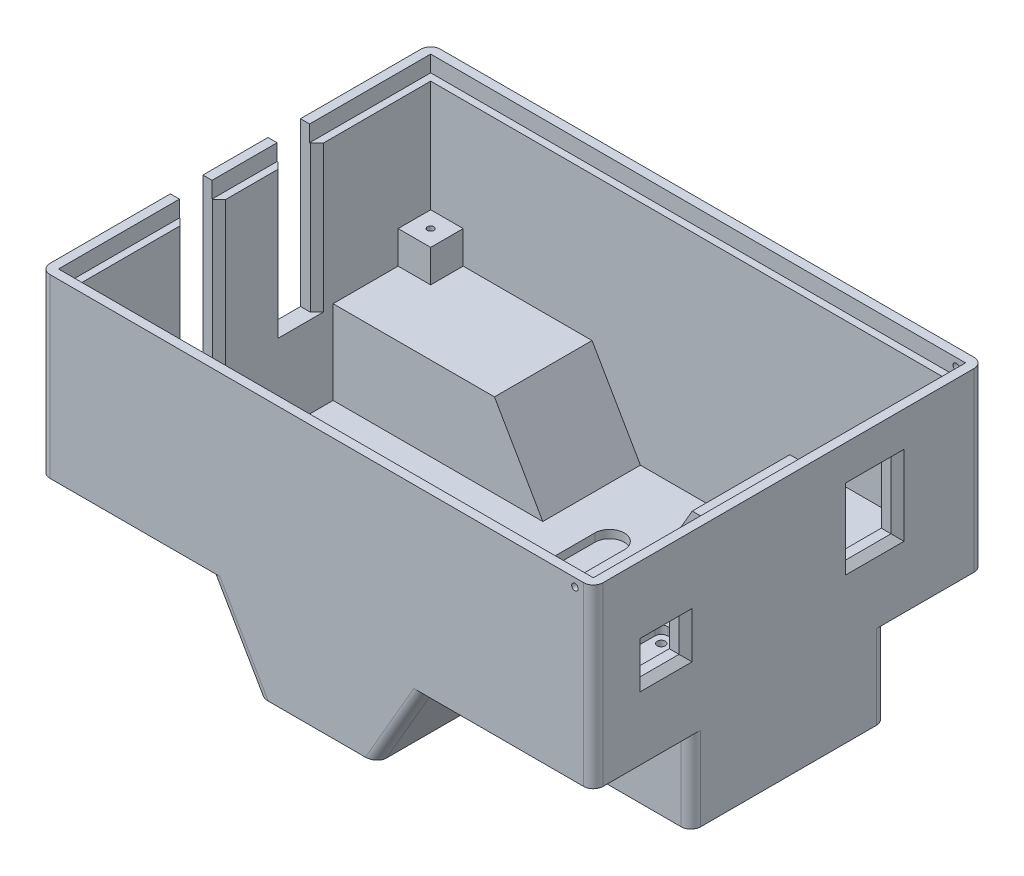
from build123d import *

# Parameters (mm, degrees)
ESBO_O7_W                = 170
ESBO_O7_H                = 120
RESSALTO_EXTRUS_O4_DEPTH = 80
CORTE_EXTRUS_O9_DEPTH    = 30
CASCA1_T                 = -5
ESBO_O9_R                = 1.25
CORTE_EXTRUS_O4_DEPTH    = 132.244047484
CORTE_EXTRUS_O5_START    = -2.5
ESBO_O10_R               = 1.25
CORTE_EXTRUS_O5_DEPTH    = 2.5
ESBO_O13_R               = 4
CORTE_EXTRUS_O7_DEPTH    = 132.244047484
CORTE_EXTRUS_O8_DEPTH    = 2.5
ESBO_O22_W               = 14
ESBO_O22_H               = 20.5
ESBO_O22_W_2             = 12.04
ESBO_O22_H_2             = 10.21
CORTE_EXTRUS_O10_DEPTH   = 193.937813816
ESBO_O23_W               = 10
ESBO_O23_H               = 50
CORTE_EXTRUS_O11_DEPTH   = 193.937813816
CHANFRO1_SIZE            = 2
FILETE2_R                = 3
ESBO_O25_W               = 164.4
ESBO_O25_H               = 114.4
CORTE_EXTRUS_O12_DEPTH   = 5
ESBO_O26_R               = 1
CORTE_EXTRUS_O13_DEPTH   = 168.406690428
ESBO_O27_W               = 10
ESBO_O27_H               = 10
ESBO_O27_R               = 1
RESSALTO_EXTRUS_O7_DEPTH = 10
CHANFRO2_SIZE            = 2


with BuildPart() as part:
    # Esboço7 → Ressalto-extrusão4 (new body)
    with BuildSketch(Plane(origin=(0, 0, 0), x_dir=(1, 0, 0), z_dir=(0, 1, 0))):
        Rectangle(ESBO_O7_W, ESBO_O7_H)
    extrude(amount=RESSALTO_EXTRUS_O4_DEPTH)

    # Esboço17 → Corte-extrusão9 (cut)
    with BuildSketch(Plane.XY.offset(60)):
        Polygon((-85, 25.75), (-33.281920983, 25.75), (-18.415151551, 0), (-85, 0), align=None)
        Polygon((85, 0), (18.415151551, 0), (33.281920983, 25.75), (85, 25.75), align=None)
    corte_extrus_o9 = extrude(amount=-CORTE_EXTRUS_O9_DEPTH, mode=Mode.SUBTRACT)

    # Espelhar3: Corte-extrusão9 across plane
    add(corte_extrus_o9.mirror(Plane.XY), mode=Mode.SUBTRACT)

    # Casca1
    casca1_openings = [part.faces().sort_by_distance(p)[0] for p in [
        (0, 80, 0),
    ]]
    offset(amount=CASCA1_T, openings=casca1_openings, kind=Kind.INTERSECTION)

    # Esboço9 → Corte-extrusão4 (cut, through all)
    with BuildSketch(Plane.XZ):
        with Locations((40.35, -13.25)):
            Circle(ESBO_O9_R)
        with Locations((32.65, -13.25)):
            Circle(ESBO_O9_R)
        with Locations((40.35, 13.25)):
            Circle(ESBO_O9_R)
        with Locations((32.65, 13.25)):
            Circle(ESBO_O9_R)
        with Locations((-30.15, 13.25)):
            Circle(ESBO_O9_R)
        with Locations((-37.85, 13.25)):
            Circle(ESBO_O9_R)
        with Locations((-30.15, -13.25)):
            Circle(ESBO_O9_R)
        with Locations((-37.85, -13.25)):
            Circle(ESBO_O9_R)
    extrude(amount=-CORTE_EXTRUS_O4_DEPTH, mode=Mode.SUBTRACT)

    # Esboço10 → Corte-extrusão5 (cut)
    # profile 1 of 2: a face of its own
    with BuildSketch(Plane(origin=(0, 5, 0), x_dir=(1, 0, 0), z_dir=(0, 1, 0)).offset(CORTE_EXTRUS_O5_START)):
        with BuildLine():
            ThreePointArc((43.35, 14.25), (42.764213562, 15.664213562), (41.35, 16.25))
            Line((41.35, 16.25), (31.65, 16.25))
            ThreePointArc((31.65, 16.25), (30.235786438, 15.664213562), (29.65, 14.25))
            Line((29.65, 14.25), (29.65, -14.25))
            ThreePointArc((29.65, -14.25), (30.235786438, -15.664213562), (31.65, -16.25))
            Line((31.65, -16.25), (41.35, -16.25))
            ThreePointArc((41.35, -16.25), (42.764213562, -15.664213562), (43.35, -14.25))
            Line((43.35, -14.25), (43.35, 14.25))
        make_face()
    # profile 2 of 2: a face of its own
    with BuildSketch(Plane(origin=(0, 5, 0), x_dir=(1, 0, 0), z_dir=(0, 1, 0)).offset(CORTE_EXTRUS_O5_START)):
        with BuildLine():
            Line((-29.15, 16.25), (-38.85, 16.25))
            ThreePointArc((-38.85, 16.25), (-40.264213562, 15.664213562), (-40.85, 14.25))
            Line((-40.85, 14.25), (-40.85, -14.25))
            ThreePointArc((-40.85, -14.25), (-40.264213562, -15.664213562), (-38.85, -16.25))
            Line((-38.85, -16.25), (-29.15, -16.25))
            ThreePointArc((-29.15, -16.25), (-27.735786438, -15.664213562), (-27.15, -14.25))
            Line((-27.15, -14.25), (-27.15, 14.25))
            ThreePointArc((-27.15, 14.25), (-27.735786438, 15.664213562), (-29.15, 16.25))
        make_face()
        with Locations((-37.85, -13.25)):
            Circle(ESBO_O10_R, mode=Mode.SUBTRACT)
        with Locations((-30.15, -13.25)):
            Circle(ESBO_O10_R, mode=Mode.SUBTRACT)
        with Locations((-37.85, 13.25)):
            Circle(ESBO_O10_R, mode=Mode.SUBTRACT)
        with Locations((-30.15, 13.25)):
            Circle(ESBO_O10_R, mode=Mode.SUBTRACT)
    extrude(amount=CORTE_EXTRUS_O5_DEPTH, mode=Mode.SUBTRACT)

    # Esboço13 → Corte-extrusão7 (cut, through all)
    with BuildSketch(Plane(origin=(0, 80, 0), x_dir=(1, 0, 0), z_dir=(0, 1, 0))):
        Circle(ESBO_O13_R)
    extrude(amount=-CORTE_EXTRUS_O7_DEPTH, mode=Mode.SUBTRACT)

    # Esboço14 → Corte-extrusão8 (cut)
    with BuildSketch(Plane(origin=(0, 5, 0), x_dir=(1, 0, 0), z_dir=(0, 1, 0))):
        with BuildLine():
            Line((-4.5, -30), (-4.5, 30))
            ThreePointArc((-4.5, 30), (0, 34.5), (4.5, 30))
            Line((4.5, 30), (4.5, -30))
            ThreePointArc((4.5, -30), (0, -34.5), (-4.5, -30))
        make_face()
    extrude(amount=-CORTE_EXTRUS_O8_DEPTH, mode=Mode.SUBTRACT)

    # Esboço22 → Corte-extrusão10 (cut, through all)
    with BuildSketch(Plane.ZY.offset(-80)):
        with Locations((-26.5, 57)):
            Rectangle(ESBO_O22_W, ESBO_O22_H)
        with Locations((37.68, 52.345)):
            Rectangle(ESBO_O22_W_2, ESBO_O22_H_2)
    extrude(amount=-CORTE_EXTRUS_O10_DEPTH, mode=Mode.SUBTRACT)

    # Esboço23 → Corte-extrusão11 (cut, through all)
    with BuildSketch(Plane(origin=(-80, 0, 0), x_dir=(0, 0, -1), z_dir=(1, 0, 0))):
        with Locations((-15, 55)):
            Rectangle(ESBO_O23_W, ESBO_O23_H)
        with Locations((15, 55)):
            Rectangle(ESBO_O23_W, ESBO_O23_H)
    extrude(amount=-CORTE_EXTRUS_O11_DEPTH, mode=Mode.SUBTRACT)

    # Chanfro1
    chanfro1_edges = [part.edges().sort_by_distance(p)[0] for p in [
        (-80, 55, 20),
        (-80, 55, -20),
        (-80, 55, -10),
        (-80, 55, 10),
    ]]
    chamfer(chanfro1_edges, length=CHANFRO1_SIZE)

    # Filete2
    filete2_edges = [part.edges().sort_by_distance(p)[0] for p in [
        (85, 12.875, 30),
        (85, 12.875, -30),
        (25.848536267, 12.875, -30),
        (25.848536267, 12.875, -60),
        (-25.848536267, 12.875, -60),
        (-25.848536267, 12.875, -30),
        (-85, 12.875, -30),
        (-85, 12.875, 30),
        (-25.848536267, 12.875, 30),
        (25.848536267, 12.875, 30),
        (25.848536267, 12.875, 60),
        (-25.848536267, 12.875, 60),
        (-85, 52.875, 60),
        (-85, 52.875, -60),
        (85, 52.875, -60),
        (85, 52.875, 60),
    ]]
    fillet(filete2_edges, radius=FILETE2_R)

    # Esboço25 → Corte-extrusão12 (cut)
    with BuildSketch(Plane(origin=(0, 80, 0), x_dir=(1, 0, 0), z_dir=(0, 1, 0))):
        Rectangle(ESBO_O25_W, ESBO_O25_H)
    extrude(amount=-CORTE_EXTRUS_O12_DEPTH, mode=Mode.SUBTRACT)

    # Esboço26 → Corte-extrusão13 (cut, through all)
    with BuildSketch(Plane(origin=(0, 0, -60), x_dir=(-1, 0, 0), z_dir=(0, 0, -1))):
        with Locations((-79.35, 77.5)):
            Circle(ESBO_O26_R)
        with Locations((62.965472747, 147.728172529)):
            Circle(ESBO_O26_R)
    extrude(amount=-CORTE_EXTRUS_O13_DEPTH, mode=Mode.SUBTRACT)

    # Esboço27 → Ressalto-extrusão7 (add)
    # profile 1 of 4: a face of its own
    with BuildSketch(Plane(origin=(0, 30.75, 0), x_dir=(1, 0, 0), z_dir=(0, 1, 0))):
        with Locations((-75, 50)):
            Rectangle(ESBO_O27_W, ESBO_O27_H)
        with Locations((-75, 50)):
            Circle(ESBO_O27_R, mode=Mode.SUBTRACT)
    # profile 2 of 4: a face of its own
    with BuildSketch(Plane(origin=(0, 30.75, 0), x_dir=(1, 0, 0), z_dir=(0, 1, 0))):
        with Locations((75, 50)):
            Rectangle(ESBO_O27_W, ESBO_O27_H)
        with Locations((75, 50)):
            Circle(ESBO_O27_R, mode=Mode.SUBTRACT)
    # profile 3 of 4: a face of its own
    with BuildSketch(Plane(origin=(0, 30.75, 0), x_dir=(1, 0, 0), z_dir=(0, 1, 0))):
        with Locations((75, -50)):
            Rectangle(ESBO_O27_W, ESBO_O27_H)
        with Locations((75, -50)):
            Circle(ESBO_O27_R, mode=Mode.SUBTRACT)
    # profile 4 of 4: a face of its own
    with BuildSketch(Plane(origin=(0, 30.75, 0), x_dir=(1, 0, 0), z_dir=(0, 1, 0))):
        with Locations((-75, -50)):
            Rectangle(ESBO_O27_W, ESBO_O27_H)
        with Locations((-75, -50)):
            Circle(ESBO_O27_R, mode=Mode.SUBTRACT)
    extrude(amount=RESSALTO_EXTRUS_O7_DEPTH)

    # Chanfro2
    chanfro2_edges = [part.edges().sort_by_distance(p)[0] for p in [
        (85, 47.24, 37.68),
        (85, 52.345, 43.7),
        (85, 57.45, 37.68),
        (85, 52.345, 31.66),
        (85, 46.75, -26.5),
        (85, 57, -19.5),
        (85, 67.25, -26.5),
        (85, 57, -33.5),
    ]]
    chamfer(chanfro2_edges, length=CHANFRO2_SIZE)


solid = part.part
